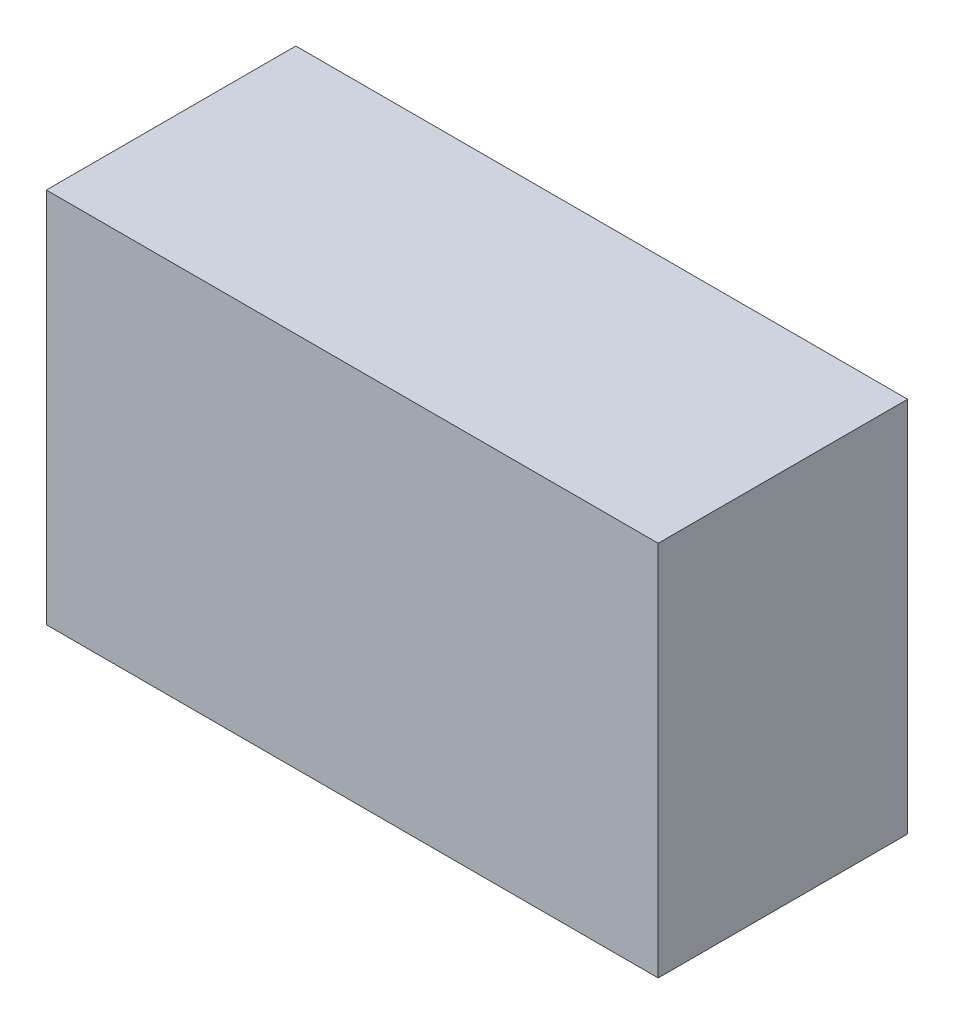
from build123d import *

# Parameters (mm, degrees)
ESQUISSE1_W        = 65
ESQUISSE1_H        = 26.5
BOSS_EXTRU_1_DEPTH = 40


with BuildPart() as part:
    # Esquisse1 → Boss.-Extru.1 (new body)
    with BuildSketch(Plane(origin=(0, 0, 0), x_dir=(1, 0, 0), z_dir=(0, 1, 0))):
        with Locations((8.839285714, -0.794642857)):
            Rectangle(ESQUISSE1_W, ESQUISSE1_H)
    extrude(amount=BOSS_EXTRU_1_DEPTH)


solid = part.part
